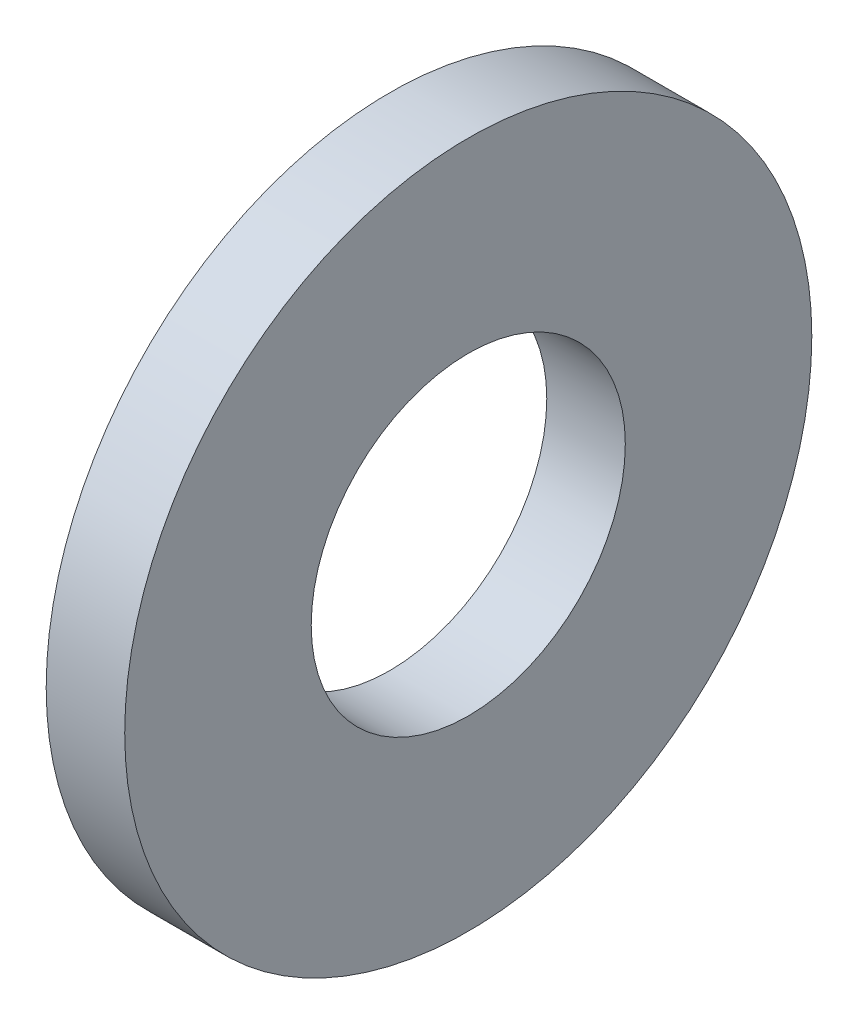
from build123d import *

# Parameters (mm, degrees)
M3_WASHER_OUTSIDE_SKETCH_R = 3.5
M3_WASHER_OUTSIDE_DEPTH    = 0.8
M3_WASHER_BORE_SKETCH_R    = 1.6
M3_WASHER_BORE_DEPTH       = 1


with BuildPart() as part:
    # M3 washer outside sketch → M3 washer outside (new body)
    with BuildSketch(Plane(origin=(53.908348754, 0, 0), x_dir=(0, 0, -1), z_dir=(1, 0, 0))):
        with Locations((12, -19)):
            Circle(M3_WASHER_OUTSIDE_SKETCH_R)
    extrude(amount=M3_WASHER_OUTSIDE_DEPTH)

    # M3 washer bore sketch → M3 washer bore (cut)
    with BuildSketch(Plane(origin=(53.808348754, 0, 0), x_dir=(0, 0, -1), z_dir=(1, 0, 0))):
        with Locations((12, -19)):
            Circle(M3_WASHER_BORE_SKETCH_R)
    extrude(amount=M3_WASHER_BORE_DEPTH, mode=Mode.SUBTRACT)


solid = part.part
